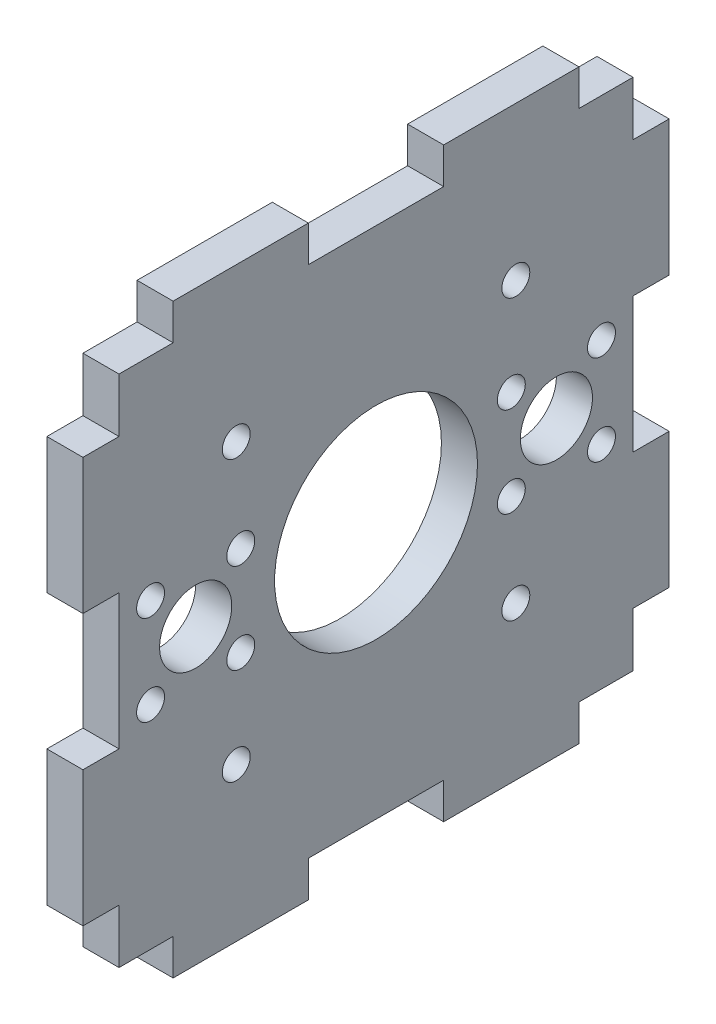
from build123d import *

# Parameters (mm, degrees)
SKETCH1_W           = 65
SKETCH1_H           = 65
BOSS_EXTRUDE1_DEPTH = 4
SKETCH2_R           = 1.55
SKETCH2_R_2         = 11.25
CUT_EXTRUDE1_DEPTH  = 4
SKETCH3_W           = 10
SKETCH3_H           = 4
SKETCH3_W_2         = 15
CUT_EXTRUDE2_DEPTH  = 4
SKETCH5_W           = 4
SKETCH5_H           = 6
SKETCH5_H_2         = 15
CUT_EXTRUDE3_DEPTH  = 4
SKETCH6_R           = 1.55
SKETCH6_R_2         = 4
CUT_EXTRUDE4_DEPTH  = 4


with BuildPart() as part:
    # Sketch1 → Boss-Extrude1 (new body)
    with BuildSketch(Plane(origin=(0, 0, 0), x_dir=(0, 0, -1), z_dir=(1, 0, 0))):
        with Locations((32.5, 32.5)):
            Rectangle(SKETCH1_W, SKETCH1_H)
    extrude(amount=BOSS_EXTRUDE1_DEPTH)

    # Sketch2 → Cut-Extrude1 (cut)
    with BuildSketch(Plane(origin=(4, 0, 0), x_dir=(0, 0, -1), z_dir=(1, 0, 0))):
        with Locations((17, 48)):
            Circle(SKETCH2_R)
        with Locations((32.5, 32.5)):
            Circle(SKETCH2_R_2)
        with Locations((48, 48)):
            Circle(SKETCH2_R)
        with Locations((48, 17)):
            Circle(SKETCH2_R)
        with Locations((17, 17)):
            Circle(SKETCH2_R)
    extrude(amount=-CUT_EXTRUDE1_DEPTH, mode=Mode.SUBTRACT)

    # Sketch3 → Cut-Extrude2 (cut)
    with BuildSketch(Plane(origin=(4, 0, 0), x_dir=(0, 0, -1), z_dir=(1, 0, 0))):
        with Locations((5, 63)):
            Rectangle(SKETCH3_W, SKETCH3_H)
        with Locations((32.5, 63)):
            Rectangle(SKETCH3_W_2, SKETCH3_H)
        with Locations((60, 63)):
            Rectangle(SKETCH3_W, SKETCH3_H)
        with Locations((60, 2)):
            Rectangle(SKETCH3_W, SKETCH3_H)
        with Locations((32.5, 2)):
            Rectangle(SKETCH3_W_2, SKETCH3_H)
        with Locations((5, 2)):
            Rectangle(SKETCH3_W, SKETCH3_H)
    extrude(amount=-CUT_EXTRUDE2_DEPTH, mode=Mode.SUBTRACT)

    # Sketch5 → Cut-Extrude3 (cut)
    with BuildSketch(Plane(origin=(4, 0, 0), x_dir=(0, 0, -1), z_dir=(1, 0, 0))):
        with Locations((2, 58)):
            Rectangle(SKETCH5_W, SKETCH5_H)
        with Locations((2, 32.5)):
            Rectangle(SKETCH5_W, SKETCH5_H_2)
        with Locations((2, 7)):
            Rectangle(SKETCH5_W, SKETCH5_H)
        with Locations((63, 7)):
            Rectangle(SKETCH5_W, SKETCH5_H)
        with Locations((63, 32.5)):
            Rectangle(SKETCH5_W, SKETCH5_H_2)
        with Locations((63, 58)):
            Rectangle(SKETCH5_W, SKETCH5_H)
    extrude(amount=-CUT_EXTRUDE3_DEPTH, mode=Mode.SUBTRACT)

    # Sketch6 → Cut-Extrude4 (cut)
    with BuildSketch(Plane(origin=(4, 0, 0), x_dir=(0, 0, -1), z_dir=(1, 0, 0))):
        with Locations((7.5, 37.5)):
            Circle(SKETCH6_R)
        with Locations((17.5, 37.5)):
            Circle(SKETCH6_R)
        with Locations((17.5, 27.5)):
            Circle(SKETCH6_R)
        with Locations((12.5, 32.5)):
            Circle(SKETCH6_R_2)
        with Locations((7.5, 27.5)):
            Circle(SKETCH6_R)
        with Locations((52.5, 32.5)):
            Circle(SKETCH6_R_2)
        with Locations((47.5, 27.5)):
            Circle(SKETCH6_R)
        with Locations((47.5, 37.5)):
            Circle(SKETCH6_R)
        with Locations((57.5, 37.5)):
            Circle(SKETCH6_R)
        with Locations((57.5, 27.5)):
            Circle(SKETCH6_R)
    extrude(amount=-CUT_EXTRUDE4_DEPTH, mode=Mode.SUBTRACT)


solid = part.part
